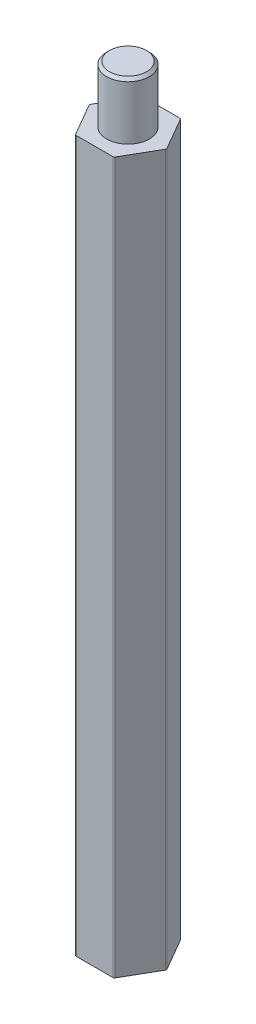
from build123d import *

# Parameters (mm, degrees)
EXTRUDE_1_DEPTH     = 50
SKETCH_2_R          = 1.5
EXTRUDE_2_DEPTH     = 4
SKETCH_3_R          = 1.5
CUT_EXTRUDE_1_DEPTH = 4
CHAMFER_1_SIZE      = 0.2
FILLET_1_R          = 0.1


with BuildPart() as part:
    # 草图1 → 凸台-拉伸1 (new body)
    with BuildSketch(Plane(origin=(0, 0, 0), x_dir=(1, 0, 0), z_dir=(0, 1, 0))):
        Polygon((2.713546265, 0), (1.356773133, 2.35), (-1.356773133, 2.35), (-2.713546265, 0), (-1.356773133, -2.35), (1.356773133, -2.35), align=None)
    extrude(amount=EXTRUDE_1_DEPTH)

    # 草图2 → 凸台-拉伸2 (add)
    with BuildSketch(Plane(origin=(0, 50, 0), x_dir=(1, 0, 0), z_dir=(0, 1, 0))):
        with Locations(Location((0, 0, 0), (0, 0, 270))):
            Circle(SKETCH_2_R)
    extrude(amount=EXTRUDE_2_DEPTH)

    # 草图3 → 切除-拉伸1 (cut)
    with BuildSketch(Plane.XZ):
        with Locations(Location((0, 0, 0), (0, 0, 90))):
            Circle(SKETCH_3_R)
    extrude(amount=-CUT_EXTRUDE_1_DEPTH, mode=Mode.SUBTRACT)

    # 倒角1
    chamfer_1_edges = [part.edges().sort_by_distance(p)[0] for p in [
        (0, 54, -1.5),
        (0, 4, -1.5),
    ]]
    chamfer(chamfer_1_edges, length=CHAMFER_1_SIZE)

    # 圆角1
    fillet_1_edges = [part.edges().sort_by_distance(p)[0] for p in [
        (1.356773133, 25, 2.35),
        (-1.356773133, 25, 2.35),
        (-2.713546265, 25, 0),
        (-1.356773133, 25, -2.35),
        (1.356773133, 25, -2.35),
        (2.713546265, 25, 0),
    ]]
    fillet(fillet_1_edges, radius=FILLET_1_R)


solid = part.part
